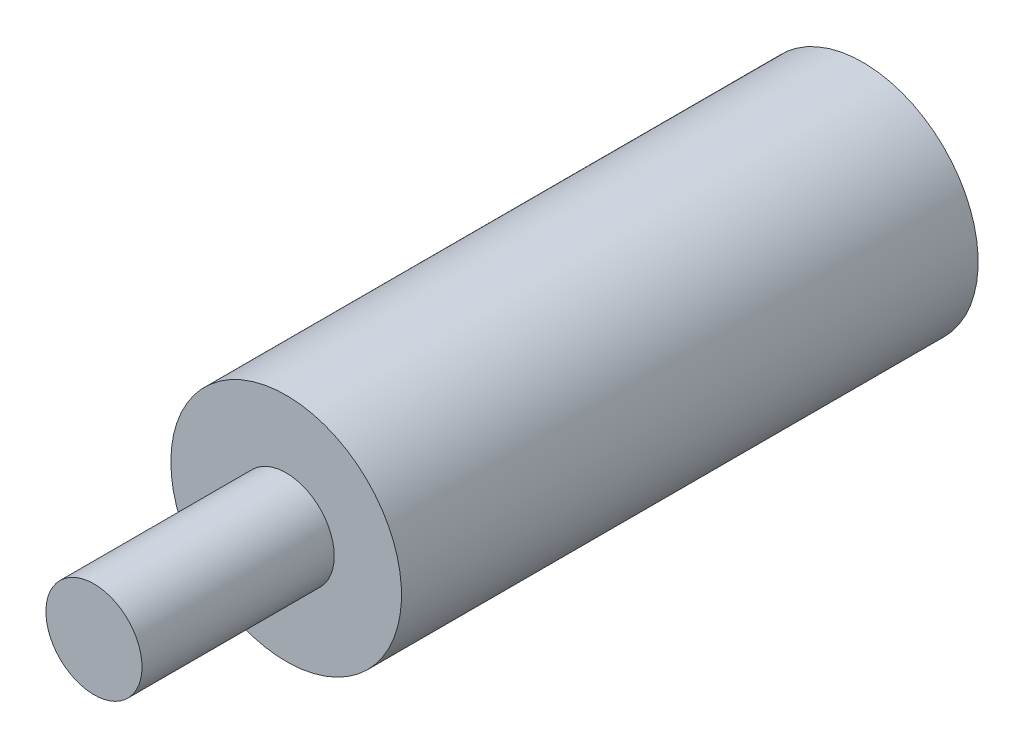
from build123d import *

# Parameters (mm, degrees)
SKETCH_1_R      = 2.5
EXTRUDE_1_DEPTH = 5
SKETCH_2_R      = 6
EXTRUDE_2_DEPTH = 30


with BuildPart() as part:
    # 草图1 → 凸台-拉伸1 (new, symmetric)
    with BuildSketch(Plane.XY):
        Circle(SKETCH_1_R)
    extrude(amount=EXTRUDE_1_DEPTH, both=True)

    # 草图2 → 凸台-拉伸2 (add)
    with BuildSketch(Plane(origin=(0, 0, -5), x_dir=(-1, 0, 0), z_dir=(0, 0, -1))):
        Circle(SKETCH_2_R)
    extrude(amount=EXTRUDE_2_DEPTH)


solid = part.part
